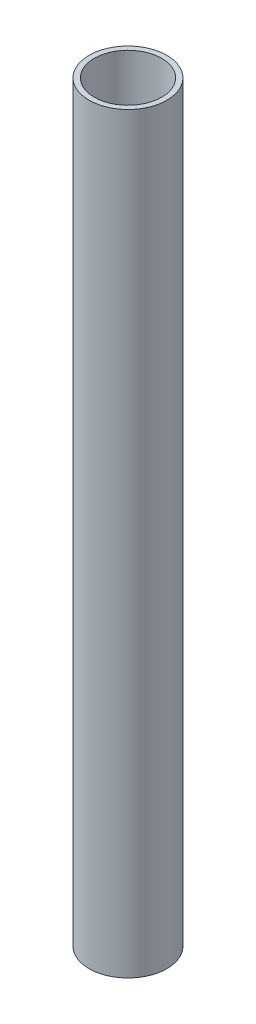
from build123d import *

# Parameters (mm, degrees)
SKETCH1_R           = 7.5
SKETCH1_R_2         = 6.5
BOSS_EXTRUDE1_DEPTH = 145


with BuildPart() as part:
    # Sketch1 → Boss-Extrude1 (new body)
    with BuildSketch(Plane(origin=(0, 0, 0), x_dir=(1, 0, 0), z_dir=(0, 1, 0))):
        with Locations(Location((0, 0, 0), (0, 0, 270))):
            Circle(SKETCH1_R)
        with Locations(Location((0, 0, 0), (0, 0, 270))):
            Circle(SKETCH1_R_2, mode=Mode.SUBTRACT)
    extrude(amount=BOSS_EXTRUDE1_DEPTH)


solid = part.part
